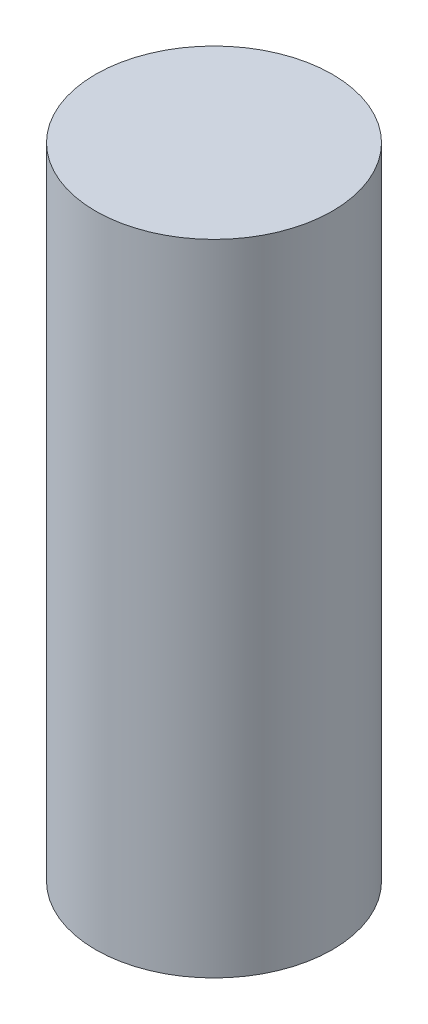
from build123d import *

# Parameters (mm, degrees)
SKETCH_1_R      = 10
EXTRUDE_1_DEPTH = 54


with BuildPart() as part:
    # 草图1 → 凸台-拉伸1 (new body)
    with BuildSketch(Plane(origin=(0, 0, 0), x_dir=(1, 0, 0), z_dir=(0, 1, 0))):
        with Locations(Location((66.407188736, -51.14638929, 0), (0, 0, 270))):
            Circle(SKETCH_1_R)
    extrude(amount=EXTRUDE_1_DEPTH)


solid = part.part
